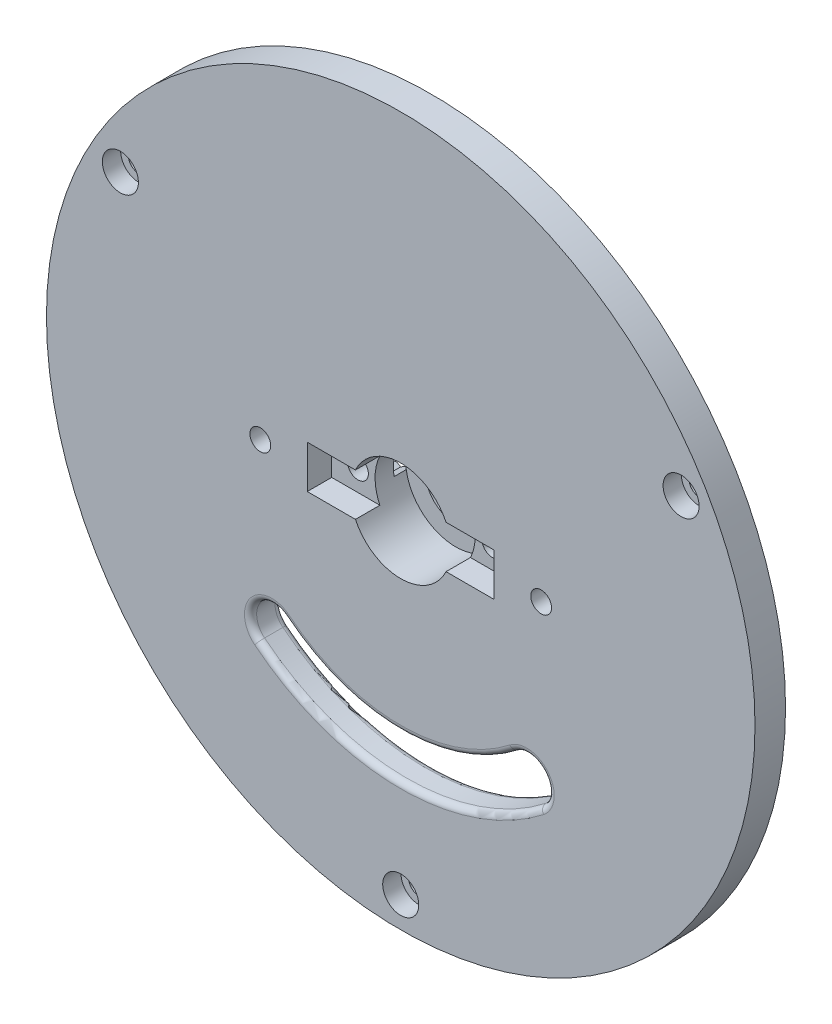
from build123d import *

# Parameters (mm, degrees)
SKETCH1_R                = 58
SKETCH1_R_2              = 8.2
SKETCH1_R_3              = 1.7
BOSS_EXTRUDE1_DEPTH      = 5
SKETCH4_W                = 30.6
SKETCH4_H                = 7
CUT_EXTRUDE2_DEPTH       = 4
CUT_EXTRUDE3_DEPTH       = 4
SKETCH6_R                = 1.7
CUT_EXTRUDE4_DEPTH       = 83.758685345
SKETCH7_R                = 2.95
CUT_EXTRUDE5_DEPTH       = 3
SKETCH8_R                = 1.7
CUT_EXTRUDE6_DEPTH       = 83.758685345
BOSS_EXTRUDE2_DEPTH      = 3
BOSS_EXTRUDE2_DEPTH_BACK = 10
CUT_EXTRUDE7_DEPTH       = 84.210576251
CUT_EXTRUDE7_DEPTH_BACK  = 84.210576251
FILLET1_R                = 1
SKETCH11_R               = 7
BOSS_EXTRUDE3_DEPTH      = 3


with BuildPart() as part:
    # Sketch1 → Boss-Extrude1 (new body)
    with BuildSketch(Plane.XY):
        Circle(SKETCH1_R)
        Circle(SKETCH1_R_2, mode=Mode.SUBTRACT)
        with Locations((0, -53)):
            Circle(SKETCH1_R_3, mode=Mode.SUBTRACT)
        with Locations((-45.899346401, 26.5)):
            Circle(SKETCH1_R_3, mode=Mode.SUBTRACT)
        with Locations((45.899346401, 26.5)):
            Circle(SKETCH1_R_3, mode=Mode.SUBTRACT)
    extrude(amount=BOSS_EXTRUDE1_DEPTH)

    # Sketch3 → Revolve1 (revolve)
    with BuildSketch(Plane(origin=(0, 0, 0), x_dir=(1, 0, 0), z_dir=(0, 1, 0)), mode=Mode.PRIVATE) as revolve1_sk:
        Polygon((-8.2, 0), (-18, 0), (-12, 6), (-5, 6), (-5, 4), (-8.2, 4), align=None)
    revolve(revolve1_sk.sketch.rotate(Axis((0, 0, 0), (0, 0, -1)), 180), axis=Axis((0, 0, 0), (0, 0, -1)))

    # Sketch4 → Cut-Extrude2 (cut)
    with BuildSketch(Plane.XY.offset(5)):
        Rectangle(SKETCH4_W, SKETCH4_H)
    extrude(amount=-CUT_EXTRUDE2_DEPTH, mode=Mode.SUBTRACT)

    # Sketch5 → Cut-Extrude3 (cut)
    with BuildSketch(Plane(origin=(0, 0, -6), x_dir=(-1, 0, 0), z_dir=(0, 0, -1))):
        Polygon((-11, 3.35), (-13.901185103, 1.675), (-13.901185103, -1.675), (-11, -3.35), (-8.098814897, -1.675), (-8.098814897, 1.675), align=None)
        Polygon((8.098814897, -1.675), (8.098814897, 1.675), (11, 3.35), (13.901185103, 1.675), (13.901185103, -1.675), (11, -3.35), align=None)
    extrude(amount=-CUT_EXTRUDE3_DEPTH, mode=Mode.SUBTRACT)

    # Sketch6 → Cut-Extrude4 (cut, through all)
    with BuildSketch(Plane(origin=(0, 0, -6), x_dir=(-1, 0, 0), z_dir=(0, 0, -1))):
        with Locations((-11, 0)):
            Circle(SKETCH6_R)
        with Locations(Location((11, 0, 0), (0, 0, 180))):
            Circle(SKETCH6_R)
    extrude(amount=-CUT_EXTRUDE4_DEPTH, mode=Mode.SUBTRACT)

    # Sketch7 → Cut-Extrude5 (cut)
    with BuildSketch(Plane.XY.offset(5)):
        with Locations((-45.899346401, 26.5)):
            Circle(SKETCH7_R)
        with Locations((45.899346401, 26.5)):
            Circle(SKETCH7_R)
        with Locations((0, -53)):
            Circle(SKETCH7_R)
    extrude(amount=-CUT_EXTRUDE5_DEPTH, mode=Mode.SUBTRACT)

    # Sketch8 → Cut-Extrude6 (cut, through all)
    with BuildSketch(Plane.XY.offset(5)):
        with Locations((22.987, 0)):
            Circle(SKETCH8_R)
        with Locations((-22.987, 0)):
            Circle(SKETCH8_R)
    extrude(amount=-CUT_EXTRUDE6_DEPTH, mode=Mode.SUBTRACT)

    # Sketch9 → Boss-Extrude2 (add, two sides: drawn at the far end of the back side and taken through both)
    with BuildSketch(Plane(origin=(0, 0, -6), x_dir=(-1, 0, 0), z_dir=(0, 0, -1)).offset(-BOSS_EXTRUDE2_DEPTH_BACK)):
        with BuildLine():
            ThreePointArc((33, 0), (22.294476851, 24.330152115), (-2.876139511, 32.874425037))
            Line((-2.876139511, 32.874425037), (-2.788983768, 31.878230339))
            ThreePointArc((-2.788983768, 31.878230339), (21.618886644, 23.592874778), (32, 0))
            ThreePointArc((32, 0), (31.969543091, -1.395820396), (31.878230339, -2.788983768))
            Line((31.878230339, -2.788983768), (32.874425037, -2.876139511))
            ThreePointArc((32.874425037, -2.876139511), (32.968591312, -1.439439783), (33, 0))
        make_face()
    extrude(amount=BOSS_EXTRUDE2_DEPTH + BOSS_EXTRUDE2_DEPTH_BACK)

    # Sketch10 → Cut-Extrude7 (cut, two sides: drawn at the far end of the back side and taken through both)
    with BuildSketch(Plane.XY.offset(5).offset(-CUT_EXTRUDE7_DEPTH_BACK)):
        with BuildLine():
            ThreePointArc((18.471052989, -23.639378196), (-0.261796154, -29.998857691), (-18.880803933, -23.313413367))
            ThreePointArc((-18.880803933, -23.313413367), (-23.803462517, -23.830551311), (-23.286324737, -28.753209912))
            ThreePointArc((-23.286324737, -28.753209912), (-0.322881815, -36.998591153), (22.780965409, -29.155233064))
            ThreePointArc((22.780965409, -29.155233064), (23.383936613, -24.242349436), (18.471052989, -23.639378196))
        make_face()
    extrude(amount=CUT_EXTRUDE7_DEPTH + CUT_EXTRUDE7_DEPTH_BACK, mode=Mode.SUBTRACT)

    # Fillet1
    fillet1_edges = [part.edges().sort_by_distance(p)[0] for p in [
        (-0.261796154, -29.998857691, 0),
        (23.383936613, -24.242349436, 0),
        (-0.322881815, -36.998591153, 0),
        (-23.803462517, -23.830551311, 0),
        (-23.803462517, -23.830551311, 5),
        (-0.322881815, -36.998591153, 5),
        (23.383936613, -24.242349436, 5),
        (-0.261796154, -29.998857691, 5),
    ]]
    fillet(fillet1_edges, radius=FILLET1_R)

    # Sketch11 → Boss-Extrude3 (add)
    # profile 1 of 2: a face of its own
    with BuildSketch(Plane(origin=(0, 0, 0), x_dir=(-1, 0, 0), z_dir=(0, 0, -1))):
        with Locations(Location((-22.987, 0, 0), (0, 0, 321.943969813))):
            Circle(SKETCH11_R)
        Polygon((-24.662, 2.901185103), (-26.337, 0), (-24.662, -2.901185103), (-21.312, -2.901185103), (-19.637, 0), (-21.312, 2.901185103), align=None, mode=Mode.SUBTRACT)
    # profile 2 of 2: a face of its own
    with BuildSketch(Plane(origin=(0, 0, 0), x_dir=(-1, 0, 0), z_dir=(0, 0, -1))):
        with Locations(Location((22.987, 0, 0), (0, 0, 180))):
            Circle(SKETCH11_R)
        Polygon((19.637, 0), (21.312, 2.901185103), (24.662, 2.901185103), (26.337, 0), (24.662, -2.901185103), (21.312, -2.901185103), align=None, mode=Mode.SUBTRACT)
    extrude(amount=BOSS_EXTRUDE3_DEPTH)


solid = part.part
